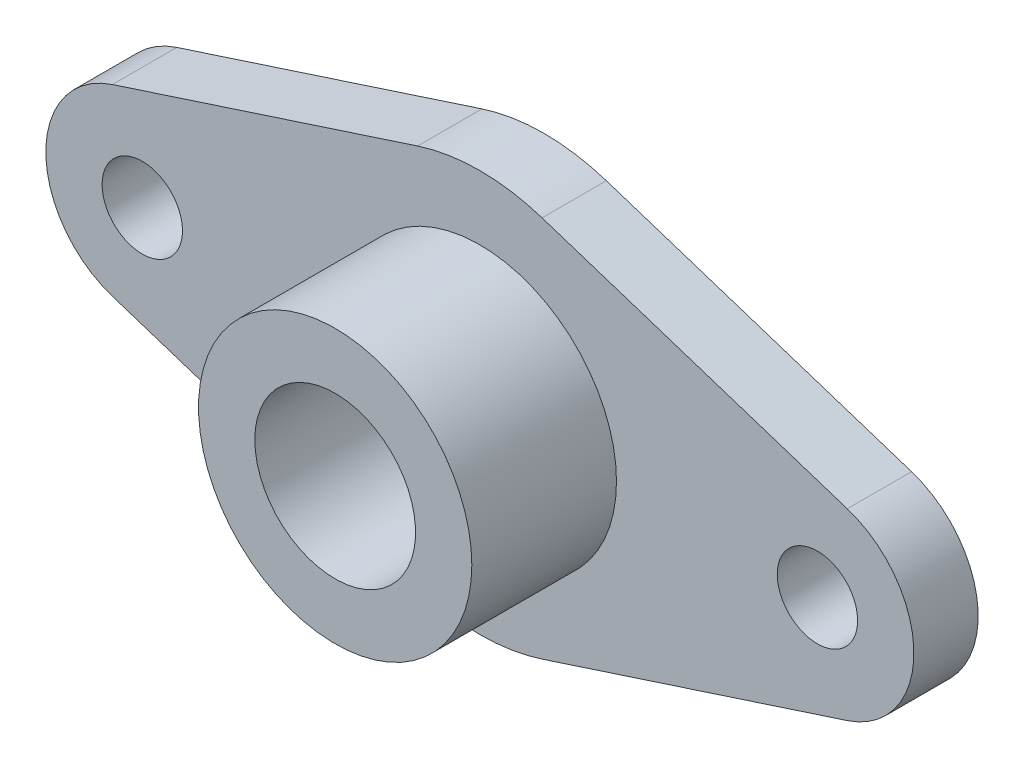
from build123d import *

# Parameters (mm, degrees)
EXTRUDE_1_DEPTH     = 8
SKETCH_2_R          = 17
EXTRUDE_2_DEPTH     = 18
SKETCH_3_R          = 10
CUT_EXTRUDE_1_DEPTH = 65.93843238
SKETCH_4_R          = 5
CUT_EXTRUDE_2_DEPTH = 65.93843238


with BuildPart() as part:
    # 草图1 → 凸台-拉伸1 (new body)
    with BuildSketch(Plane.XY):
        with BuildLine():
            Line((-7.738095, 23.7723), (-45.714286, 11.410704))
            ThreePointArc((-45.714286, 11.410704), (-54, 0), (-45.714286, -11.410704))
            Line((-45.714286, -11.410704), (-7.738095, -23.7723))
            ThreePointArc((-7.738095, -23.7723), (0, -25), (7.738095, -23.7723))
            Line((7.738095, -23.7723), (45.714286, -11.410704))
            ThreePointArc((45.714286, -11.410704), (54, 0), (45.714286, 11.410704))
            Line((45.714286, 11.410704), (7.738095, 23.7723))
            ThreePointArc((7.738095, 23.7723), (0, 25), (-7.738095, 23.7723))
        make_face()
    extrude(amount=EXTRUDE_1_DEPTH)

    # 草图2 → 凸台-拉伸2 (add)
    with BuildSketch(Plane.XY.offset(8)):
        Circle(SKETCH_2_R)
    extrude(amount=EXTRUDE_2_DEPTH)

    # 草图3 → 切除-拉伸1 (cut, through all)
    with BuildSketch(Plane.XY):
        with Locations(Location((0, 0, 0), (0, 0, 180))):
            Circle(SKETCH_3_R)
    extrude(amount=CUT_EXTRUDE_1_DEPTH, mode=Mode.SUBTRACT)

    # 草图4 → 切除-拉伸2 (cut, through all)
    with BuildSketch(Plane.XY):
        with Locations(Location((42, 0, 0), (0, 0, 180))):
            Circle(SKETCH_4_R)
        with Locations(Location((-42, 0, 0), (0, 0, 180))):
            Circle(SKETCH_4_R)
    extrude(amount=CUT_EXTRUDE_2_DEPTH, mode=Mode.SUBTRACT)


solid = part.part
